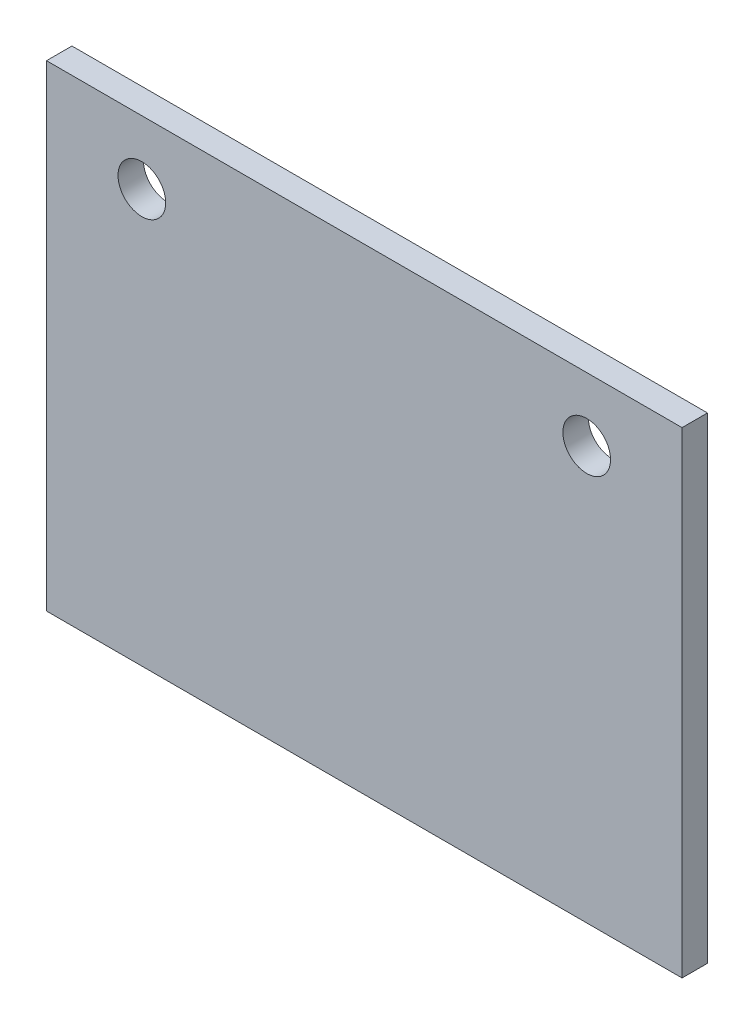
from build123d import *

# Parameters (mm, degrees)
SKETCH_1_W      = 40
SKETCH_1_H      = 30
SKETCH_1_R      = 1.5
EXTRUDE_1_DEPTH = 1.6


with BuildPart() as part:
    # Эскиз1 → Бобышка-Вытянуть1 (new body)
    with BuildSketch(Plane.XY):
        Rectangle(SKETCH_1_W, SKETCH_1_H)
        with Locations((-14, 11)):
            Circle(SKETCH_1_R, mode=Mode.SUBTRACT)
        with Locations(Location((14, 11, 0), (0, 0, 180))):
            Circle(SKETCH_1_R, mode=Mode.SUBTRACT)
    extrude(amount=EXTRUDE_1_DEPTH)


solid = part.part
